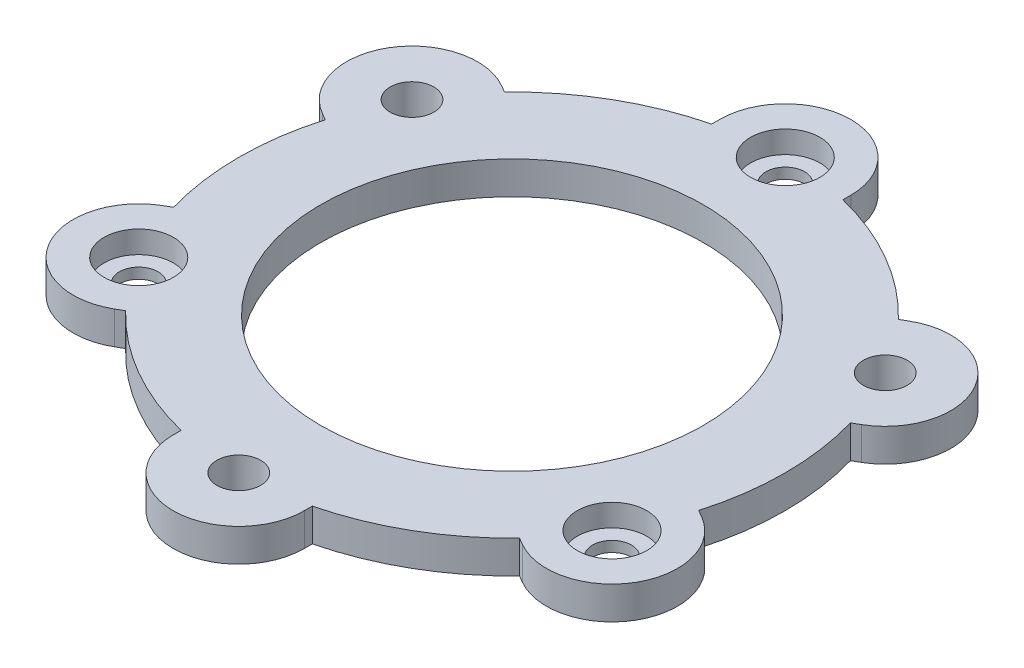
from build123d import *

# Parameters (mm, degrees)
SKETCH1_R                                      = 8.75
SKETCH1_R_2                                    = 1
BOSS_EXTRUDE1_DEPTH                            = 1.5
CBORE_FOR_0_SOCKET_HEAD_CAP_SCREW2_D           = 1.778
CBORE_FOR_0_SOCKET_HEAD_CAP_SCREW2_DEPTH       = 7.5
CBORE_FOR_0_SOCKET_HEAD_CAP_SCREW2_CBORE_D     = 3.175
CBORE_FOR_0_SOCKET_HEAD_CAP_SCREW2_CBORE_DEPTH = 1.016
CBORE_FOR_0_SOCKET_HEAD_CAP_SCREW2_TIP         = 0.53416509


with BuildPart() as part:
    # Sketch1 → Boss-Extrude1 (new body)
    with BuildSketch(Plane(origin=(0, 0, 0), x_dir=(1, 0, 0), z_dir=(0, 1, 0))):
        with BuildLine():
            Line((-3, -12.1346611), (-3, -12.5))
            ThreePointArc((-3, -12.5), (0, -15.5), (3, -12.5))
            Line((3, -12.5), (3, -12.1346611))
            ThreePointArc((3, -12.1346611), (6.25, -10.825317547), (9.008924778, -8.665406761))
            Line((9.008924778, -8.665406761), (9.325317547, -8.848076211))
            ThreePointArc((9.325317547, -8.848076211), (13.423393759, -7.75), (12.325317547, -3.651923789))
            Line((12.325317547, -3.651923789), (12.008924778, -3.469254338))
            ThreePointArc((12.008924778, -3.469254338), (12.5, 0), (12.008924778, 3.469254338))
            Line((12.008924778, 3.469254338), (12.325317547, 3.651923789))
            ThreePointArc((12.325317547, 3.651923789), (13.423393759, 7.75), (9.325317547, 8.848076211))
            Line((9.325317547, 8.848076211), (9.008924778, 8.665406761))
            ThreePointArc((9.008924778, 8.665406761), (6.25, 10.825317547), (3, 12.1346611))
            Line((3, 12.1346611), (3, 12.5))
            ThreePointArc((3, 12.5), (0, 15.5), (-3, 12.5))
            Line((-3, 12.5), (-3, 12.1346611))
            ThreePointArc((-3, 12.1346611), (-6.25, 10.825317547), (-9.008924778, 8.665406761))
            Line((-9.008924778, 8.665406761), (-9.325317547, 8.848076211))
            ThreePointArc((-9.325317547, 8.848076211), (-13.423393759, 7.75), (-12.325317547, 3.651923789))
            Line((-12.325317547, 3.651923789), (-12.008924778, 3.469254338))
            ThreePointArc((-12.008924778, 3.469254338), (-12.5, 0), (-12.008924778, -3.469254338))
            Line((-12.008924778, -3.469254338), (-12.325317547, -3.651923789))
            ThreePointArc((-12.325317547, -3.651923789), (-13.423393759, -7.75), (-9.325317547, -8.848076211))
            Line((-9.325317547, -8.848076211), (-9.008924778, -8.665406761))
            ThreePointArc((-9.008924778, -8.665406761), (-6.25, -10.825317547), (-3, -12.1346611))
        make_face()
        with Locations(Location((0, 0, 0), (0, 0, 270))):
            Circle(SKETCH1_R, mode=Mode.SUBTRACT)
        with Locations(Location((-10.825317547, 6.25, 0), (0, 0, 270))):
            Circle(SKETCH1_R_2, mode=Mode.SUBTRACT)
        with Locations(Location((10.825317547, 6.25, 0), (0, 0, 270))):
            Circle(SKETCH1_R_2, mode=Mode.SUBTRACT)
        with Locations(Location((0, -12.5, 0), (0, 0, 270))):
            Circle(SKETCH1_R_2, mode=Mode.SUBTRACT)
    extrude(amount=BOSS_EXTRUDE1_DEPTH)

    # CBORE for #0 Socket Head Cap Screw2
    with Locations(Plane(origin=(-10.825317547, 1.5, 6.25), x_dir=(0, 0, 1), z_dir=(0, 1, 0))):
        with Locations((0, 0), (-18.75, 10.825317547), (0, 21.650635094)):
            CounterBoreHole(CBORE_FOR_0_SOCKET_HEAD_CAP_SCREW2_D / 2, CBORE_FOR_0_SOCKET_HEAD_CAP_SCREW2_CBORE_D / 2, CBORE_FOR_0_SOCKET_HEAD_CAP_SCREW2_CBORE_DEPTH, depth=CBORE_FOR_0_SOCKET_HEAD_CAP_SCREW2_DEPTH)
            with Locations((0, 0, -(CBORE_FOR_0_SOCKET_HEAD_CAP_SCREW2_DEPTH + CBORE_FOR_0_SOCKET_HEAD_CAP_SCREW2_TIP / 2))):  # 118° drill point
                Cone(0, CBORE_FOR_0_SOCKET_HEAD_CAP_SCREW2_D / 2, CBORE_FOR_0_SOCKET_HEAD_CAP_SCREW2_TIP, mode=Mode.SUBTRACT)


solid = part.part
